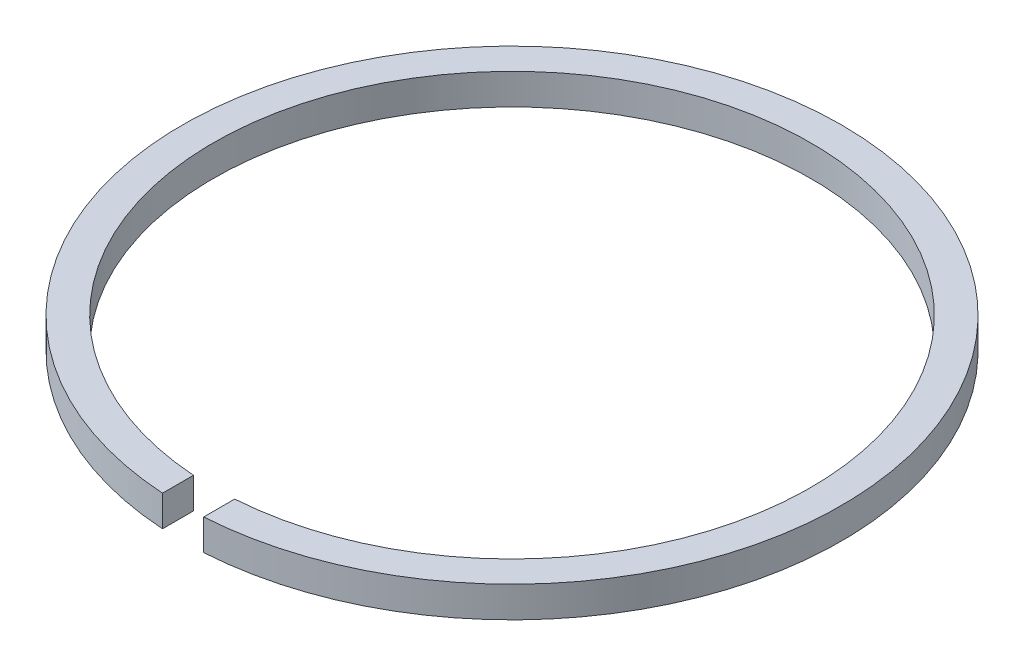
from build123d import *

# Parameters (mm, degrees)
BOSS_EXTRUDE2_DEPTH = 1.5


with BuildPart() as part:
    # Sketch1 → Boss-Extrude2 (new body)
    with BuildSketch(Plane(origin=(0, 0, 0), x_dir=(1, 0, 0), z_dir=(0, 1, 0))):
        with BuildLine():
            Line((1, -14.465476141), (1, -15.968719423))
            ThreePointArc((1, -15.968719423), (0, 16), (-1, -15.968719423))
            Line((-1, -15.968719423), (-1, -14.465476141))
            ThreePointArc((-1, -14.465476141), (0, 14.5), (1, -14.465476141))
        make_face()
    extrude(amount=BOSS_EXTRUDE2_DEPTH)


solid = part.part
